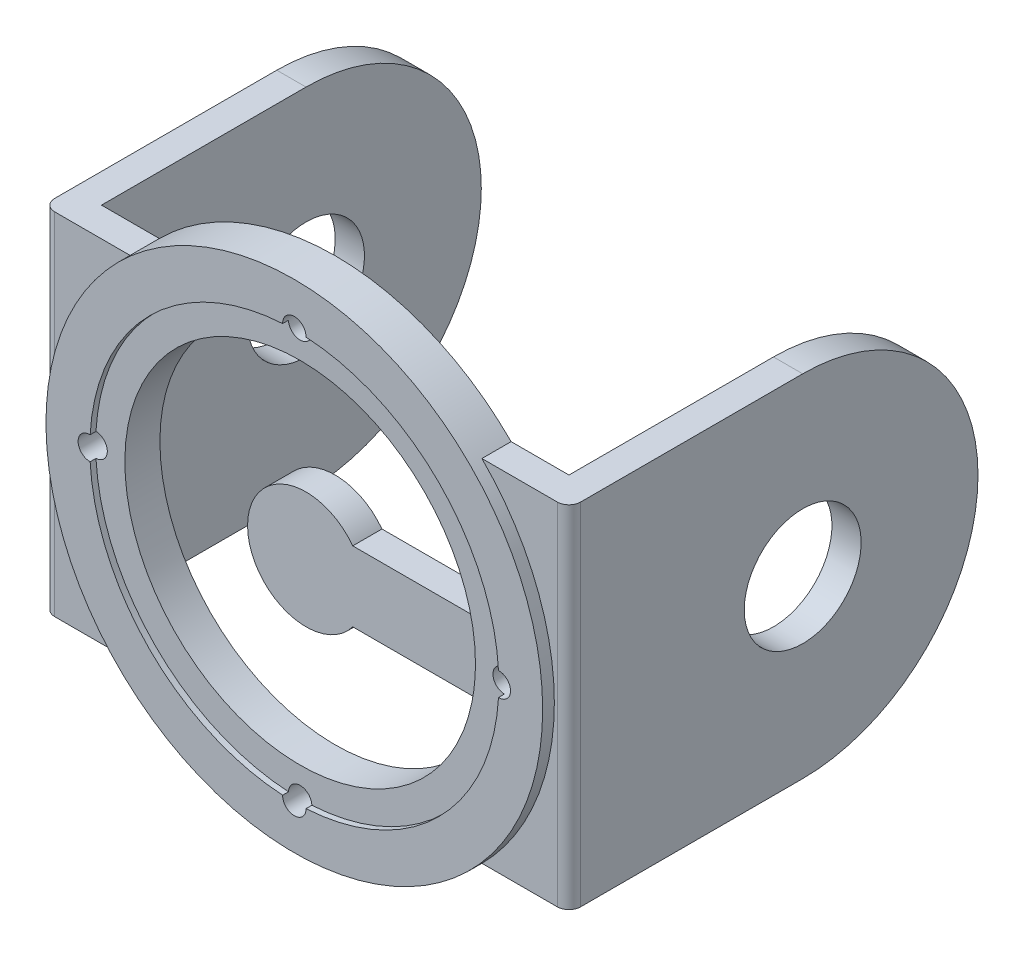
from build123d import *

# Parameters (mm, degrees)
SKETCH_1_R             = 30
EXTRUDE_1_DEPTH        = 5
SKETCH_2_R             = 35
SKETCH_2_R_2           = 30
EXTRUDE_2_DEPTH        = 1
SKETCH_4_R             = 42.5
SKETCH_4_R_2           = 35
EXTRUDE_3_DEPTH        = 2
SKETCH_5_R             = 2
CUT_EXTRUDE_3_DEPTH    = 61.51033
SKETCH_6_R             = 10
EXTRUDE_4_DEPTH        = 5
FILLET_1_R             = 2
FILLET_1_OF_MIRROR_1_R = 2
EXTRUDE_5_DEPTH        = 5


with BuildPart() as part:
    # 草图1 → 凸台-拉伸1 (new body)
    with BuildSketch(Plane.XY):
        with BuildLine():
            Line((-30.103986, -30), (-40, -30))
            Line((-40, -30), (-40, 30))
            Line((-40, 30), (-30.103986, 30))
            ThreePointArc((-30.103986, 30), (0, 42.5), (30.103986, 30))
            Line((30.103986, 30), (40, 30))
            Line((40, 30), (40, -30))
            Line((40, -30), (30.103986, -30))
            ThreePointArc((30.103986, -30), (0, -42.5), (-30.103986, -30))
        make_face()
        Circle(SKETCH_1_R, mode=Mode.SUBTRACT)
    extrude(amount=EXTRUDE_1_DEPTH)

    # 草图2 → 凸台-拉伸2 (add)
    with BuildSketch(Plane.XY.offset(5)):
        Circle(SKETCH_2_R)
        Circle(SKETCH_2_R_2, mode=Mode.SUBTRACT)
    extrude(amount=EXTRUDE_2_DEPTH)

    # 草图4 → 凸台-拉伸3 (add)
    with BuildSketch(Plane.XY.offset(5)):
        with Locations(Location((0, 0, 0), (0, 0, 160.250077))):
            Circle(SKETCH_4_R)
        Circle(SKETCH_4_R_2, mode=Mode.SUBTRACT)
    extrude(amount=EXTRUDE_3_DEPTH)

    # 草图5 → 切除-拉伸3 (cut, through all)
    with BuildSketch(Plane(origin=(0, 0, 0), x_dir=(-1, 0, 0), z_dir=(0, 0, -1))):
        with Locations((0, 35)):
            Circle(SKETCH_5_R)
        with Locations((35, 0)):
            Circle(SKETCH_5_R)
        with Locations((0, -35)):
            Circle(SKETCH_5_R)
        with Locations((-35, 0)):
            Circle(SKETCH_5_R)
    extrude(amount=-CUT_EXTRUDE_3_DEPTH, mode=Mode.SUBTRACT)

    # 草图6 → 凸台-拉伸4 (add)
    with BuildSketch(Plane.ZY.offset(40)):
        with BuildLine():
            Line((5, -30), (-35, -30))
            ThreePointArc((-35, -30), (-65, 0), (-35, 30))
            Line((-35, 30), (5, 30))
            Line((5, 30), (5, -30))
        make_face()
        with Locations((-35, 0)):
            Circle(SKETCH_6_R, mode=Mode.SUBTRACT)
    extrude_4 = extrude(amount=EXTRUDE_4_DEPTH)

    # 圆角1
    fillet_1_edges = [part.edges().sort_by_distance(p)[0] for p in [
        (-45, 0, 5),
    ]]
    fillet(fillet_1_edges, radius=FILLET_1_R)

    # 镜向1: 凸台-拉伸4 across plane
    add(extrude_4.mirror(Plane(origin=(0, 0, 0), x_dir=(0, 0, 1), z_dir=(1, 0, 0))))

    # 圆角1 of 镜向1
    fillet_1_of_mirror_1_edges = [part.edges().sort_by_distance(p)[0] for p in [
        (45, 0, 5),
    ]]
    fillet(fillet_1_of_mirror_1_edges, radius=FILLET_1_OF_MIRROR_1_R)

    # 草图7 → 凸台-拉伸5 (add)
    with BuildSketch(Plane(origin=(0, 0, 0), x_dir=(-1, 0, 0), z_dir=(0, 0, -1))):
        with BuildLine():
            Line((-8, -6), (-29.686217, -6))
            ThreePointArc((-29.686217, -6), (-30.28649, 0), (-29.686217, 6))
            Line((-29.686217, 6), (-8, 6))
            ThreePointArc((-8, 6), (10, 0), (-8, -6))
        make_face()
    extrude(amount=-EXTRUDE_5_DEPTH)


solid = part.part
